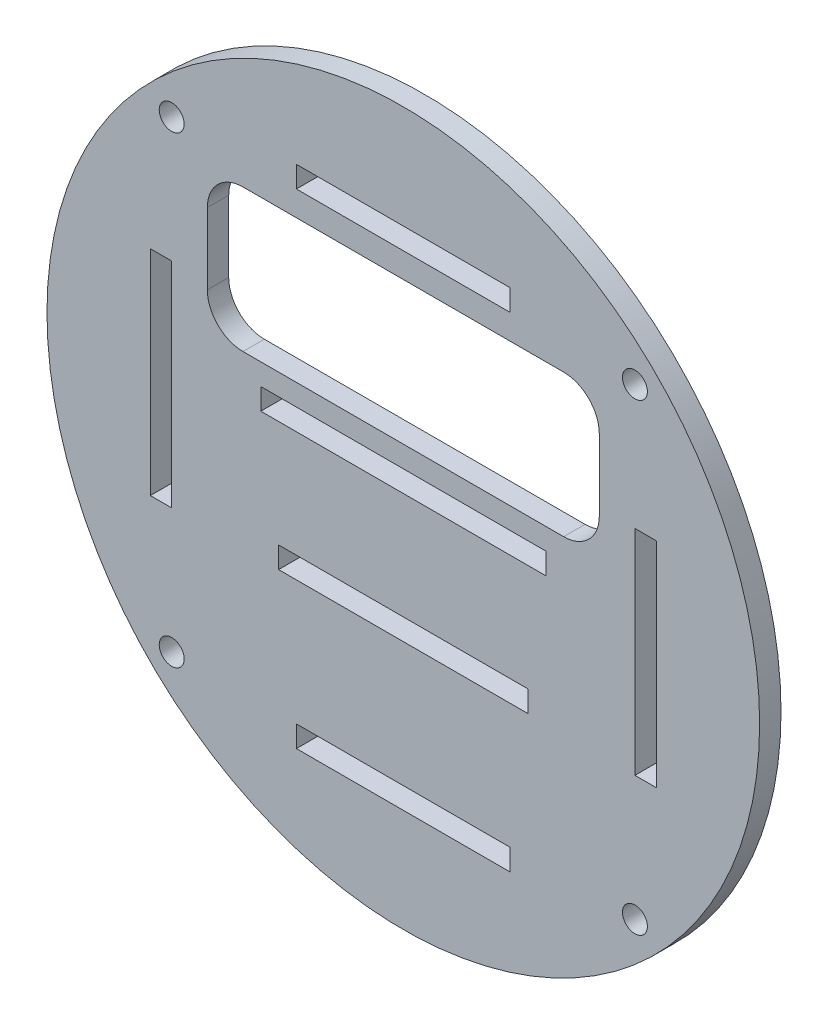
from build123d import *

# Parameters (mm, degrees)
SKETCH_1_R          = 50
EXTRUDE_1_DEPTH     = 3
SKETCH_2_W          = 30
SKETCH_2_H          = 3
SKETCH_2_W_2        = 35
SKETCH_2_W_3        = 40
CUT_EXTRUDE_1_DEPTH = 8
CUT_EXTRUDE_2_DEPTH = 10
SKETCH_4_W          = 2.995674625
SKETCH_4_H          = 30
CUT_EXTRUDE_3_DEPTH = 10
SKETCH_5_R          = 1.75
CUT_EXTRUDE_4_DEPTH = 10


with BuildPart() as part:
    # Эскиз1 → Бобышка-Вытянуть1 (new body)
    with BuildSketch(Plane.XY):
        Circle(SKETCH_1_R)
    extrude(amount=EXTRUDE_1_DEPTH)

    # Эскиз2 → Вырез-Вытянуть1 (cut)
    with BuildSketch(Plane.XY.offset(3)):
        with Locations((0, -34)):
            Rectangle(SKETCH_2_W, SKETCH_2_H)
        with Locations((0, -13.5)):
            Rectangle(SKETCH_2_W_2, SKETCH_2_H)
        with Locations((0, 4.5)):
            Rectangle(SKETCH_2_W_3, SKETCH_2_H)
        with Locations((0, 34)):
            Rectangle(SKETCH_2_W, SKETCH_2_H)
    extrude(amount=-CUT_EXTRUDE_1_DEPTH, mode=Mode.SUBTRACT)

    # Эскиз3 → Вырез-Вытянуть2 (cut)
    with BuildSketch(Plane(origin=(0, 0, 0), x_dir=(-1, 0, 0), z_dir=(0, 0, -1))):
        with BuildLine():
            Line((-22.5, 29), (22.5, 29))
            ThreePointArc((22.5, 29), (26.035533906, 27.535533906), (27.5, 24))
            Line((27.5, 24), (27.5, 14))
            ThreePointArc((27.5, 14), (26.035533906, 10.464466094), (22.5, 9))
            Line((22.5, 9), (-22.5, 9))
            ThreePointArc((-22.5, 9), (-26.035533906, 10.464466094), (-27.5, 14))
            Line((-27.5, 14), (-27.5, 24))
            ThreePointArc((-27.5, 24), (-26.035533906, 27.535533906), (-22.5, 29))
        make_face()
    extrude(amount=-CUT_EXTRUDE_2_DEPTH, mode=Mode.SUBTRACT)

    # Эскиз4 → Вырез-Вытянуть3 (cut)
    with BuildSketch(Plane(origin=(0, 0, 0), x_dir=(-1, 0, 0), z_dir=(0, 0, -1))):
        with Locations((-33.997837312, 0)):
            Rectangle(SKETCH_4_W, SKETCH_4_H)
        with Locations((33.997837312, 0)):
            Rectangle(SKETCH_4_W, SKETCH_4_H)
    extrude(amount=-CUT_EXTRUDE_3_DEPTH, mode=Mode.SUBTRACT)

    # Эскиз5 → Вырез-Вытянуть4 (cut)
    with BuildSketch(Plane.XY.offset(3)):
        with Locations((-32.5, 32.5)):
            Circle(SKETCH_5_R)
        with Locations((32.5, 32.5)):
            Circle(SKETCH_5_R)
        with Locations((32.5, -32.5)):
            Circle(SKETCH_5_R)
        with Locations((-32.5, -32.5)):
            Circle(SKETCH_5_R)
    extrude(amount=-CUT_EXTRUDE_4_DEPTH, mode=Mode.SUBTRACT)


solid = part.part
